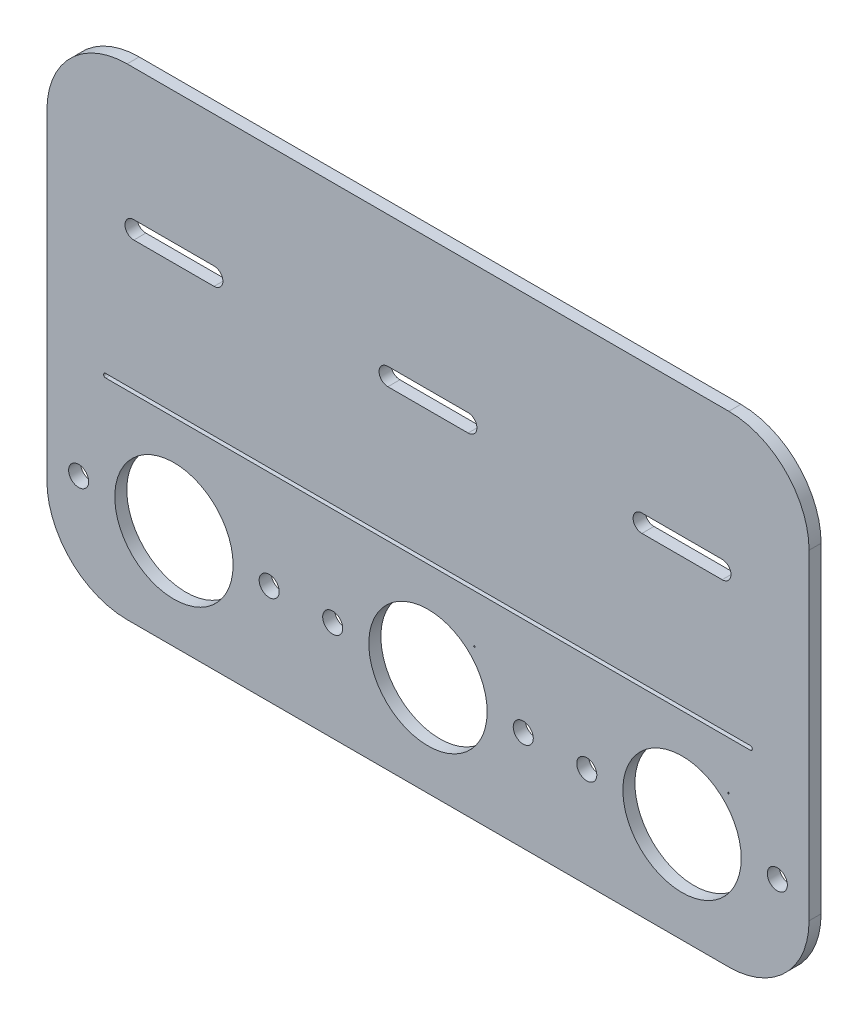
from build123d import *

# Parameters (mm, degrees)
SKETCH1_W           = 190
SKETCH1_H           = 50
BOSS_EXTRUDE1_DEPTH = 3
SKETCH2_R           = 14.75
SKETCH2_R_2         = 0.185342338
SKETCH2_R_3         = 2.5
CUT_EXTRUDE1_DEPTH  = 99.28021164
LPATTERN1_COUNT     = 3
LPATTERN1_PITCH     = 63.333333333
SKETCH3_W           = 190
SKETCH3_H           = 70
BOSS_EXTRUDE2_DEPTH = 3
CUT_EXTRUDE2_DEPTH  = 3
LPATTERN2_COUNT     = 3
LPATTERN2_PITCH     = 63.333333333
CUT_EXTRUDE3_DEPTH  = 1
FILLET1_R           = 20
FILLET2_R           = 20


with BuildPart() as part:
    # Sketch1 → Boss-Extrude1 (new body)
    with BuildSketch(Plane.XY):
        Rectangle(SKETCH1_W, SKETCH1_H)
    extrude(amount=BOSS_EXTRUDE1_DEPTH)

    # Sketch2 → Cut-Extrude1 (cut, through all)
    with BuildSketch(Plane.XY.offset(3)):
        with Locations((-63.333333333, 0)):
            Circle(SKETCH2_R)
        with Locations((11.583896138, 12.510607829)):
            Circle(SKETCH2_R_2)
        with Locations((-87.083333333, 0)):
            Circle(SKETCH2_R_3)
        with Locations(Location((-39.583333333, 0, 0), (0, 0, 180))):
            Circle(SKETCH2_R_3)
    cut_extrude1 = extrude(amount=-CUT_EXTRUDE1_DEPTH, mode=Mode.SUBTRACT)

    # LPattern1: Cut-Extrude1 ×3
    with Locations(*[(i * LPATTERN1_PITCH, 0, 0) for i in range(1, LPATTERN1_COUNT)]):
        add(cut_extrude1, mode=Mode.SUBTRACT)

    # Sketch3 → Boss-Extrude2 (add)
    with BuildSketch(Plane.XY.offset(3)):
        with Locations((0, 60)):
            Rectangle(SKETCH3_W, SKETCH3_H)
    extrude(amount=-BOSS_EXTRUDE2_DEPTH)

    # Sketch3<3> → Cut-Extrude2 (cut)
    with BuildSketch(Plane.XY.offset(3)):
        with BuildLine():
            Line((73.333333333, 62.2), (53.333333333, 62.2))
            ThreePointArc((53.333333333, 62.2), (51.133333333, 60), (53.333333333, 57.8))
            Line((53.333333333, 57.8), (73.333333333, 57.8))
            ThreePointArc((73.333333333, 57.8), (75.533333333, 60), (73.333333333, 62.2))
        make_face()
    cut_extrude2 = extrude(amount=-CUT_EXTRUDE2_DEPTH, mode=Mode.SUBTRACT)

    # LPattern2: Cut-Extrude2 ×3
    with Locations(*[(-i * LPATTERN2_PITCH, 0, 0) for i in range(1, LPATTERN2_COUNT)]):
        add(cut_extrude2, mode=Mode.SUBTRACT)

    # Sketch4 → Cut-Extrude3 (cut)
    with BuildSketch(Plane.XY.offset(3)):
        with BuildLine():
            Line((80.361283663, 25.5), (-80.361283663, 25.5))
            ThreePointArc((-80.361283663, 25.5), (-80.861283663, 25), (-80.361283663, 24.5))
            Line((-80.361283663, 24.5), (80.361283663, 24.5))
            ThreePointArc((80.361283663, 24.5), (80.861283663, 25), (80.361283663, 25.5))
        make_face()
    extrude(amount=-CUT_EXTRUDE3_DEPTH, mode=Mode.SUBTRACT)

    # Fillet1
    fillet1_edges = [part.edges().sort_by_distance(p)[0] for p in [
        (95, -25, 1.5),
        (-95, -25, 1.5),
    ]]
    fillet(fillet1_edges, radius=FILLET1_R)

    # Fillet2
    fillet2_edges = [part.edges().sort_by_distance(p)[0] for p in [
        (95, 95, 1.5),
        (-95, 95, 1.5),
    ]]
    fillet(fillet2_edges, radius=FILLET2_R)


solid = part.part
